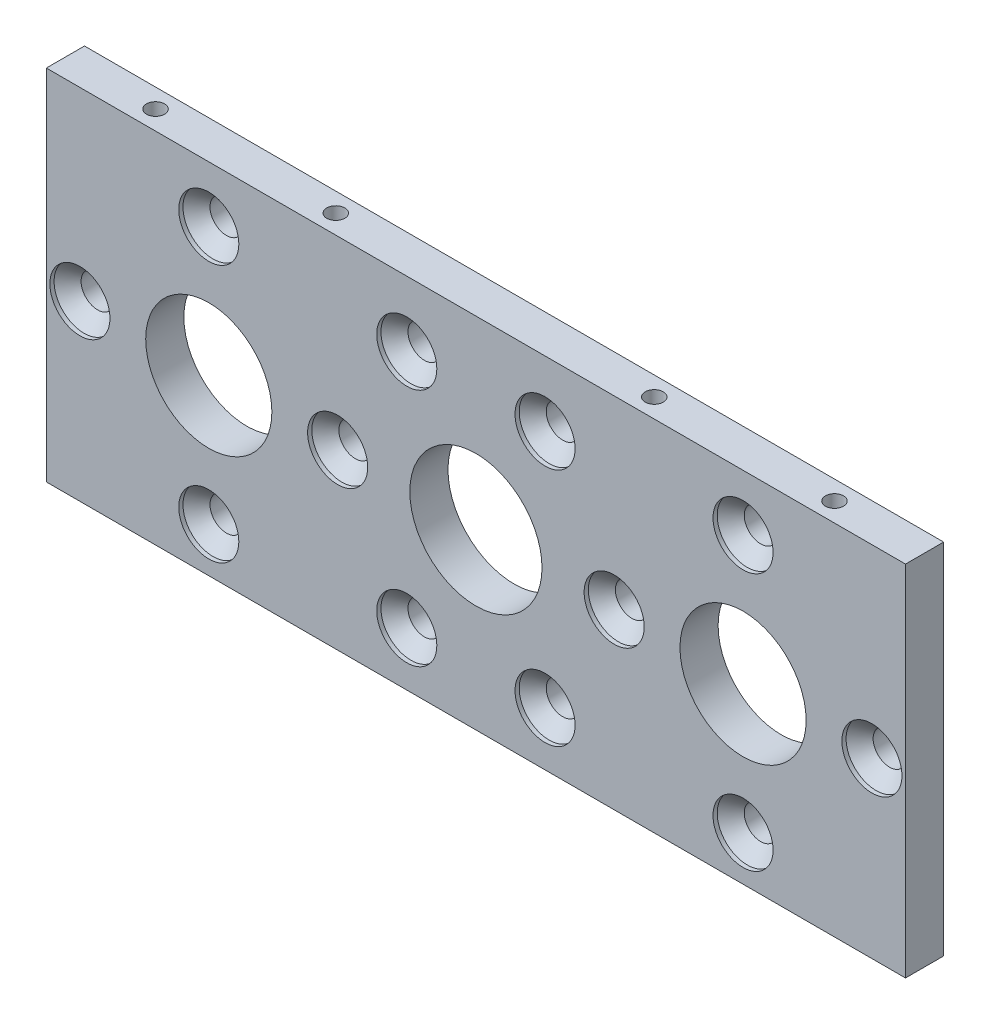
from build123d import *

# Parameters (mm, degrees)
ESBO_O1_W                        = 143.01
ESBO_O1_H                        = 54.05
RESSALTO_EXTRUS_O1_DEPTH         = 6.35
ESBO_O2_R                        = 2.75
CORTE_EXTRUS_O1_DEPTH            = 10
ESBO_O3_R                        = 10.5
ESBO_O3_R_2                      = 11
CORTE_EXTRUS_O2_DEPTH            = 10
ESBO_O4_W                        = 143.01
ESBO_O4_H                        = 3.62
RESSALTO_EXTRUS_O2_DEPTH         = 6.35
CROQUIS1_W                       = 143.01
CROQUIS1_H                       = 2
SALIENTE_EXTRUIR1_DEPTH          = 6.35
ESBO_O8_R                        = 1.5
CORTE_EXTRUS_O3_DEPTH            = 17
ESBO_O9_R                        = 5
CORTE_EXTRUS_O4_DEPTH            = 0.7
ESBO_O12_R                       = 5
CORTE_EXTRUS_O5_DEPTH            = 2.5
CORTE_EXTRUS_O5_DRAFT            = -45
CORTE_EXTRUS_O5_PROFILE_2_DEPTH  = 2.5
CORTE_EXTRUS_O5_PROFILE_2_DRAFT  = -45
CORTE_EXTRUS_O5_PROFILE_3_DEPTH  = 2.5
CORTE_EXTRUS_O5_PROFILE_3_DRAFT  = -45
CORTE_EXTRUS_O5_PROFILE_4_DEPTH  = 2.5
CORTE_EXTRUS_O5_PROFILE_4_DRAFT  = -45
CORTE_EXTRUS_O5_PROFILE_5_DEPTH  = 2.5
CORTE_EXTRUS_O5_PROFILE_5_DRAFT  = -45
CORTE_EXTRUS_O5_PROFILE_6_DEPTH  = 2.5
CORTE_EXTRUS_O5_PROFILE_6_DRAFT  = -45
CORTE_EXTRUS_O5_PROFILE_7_DEPTH  = 2.5
CORTE_EXTRUS_O5_PROFILE_7_DRAFT  = -45
CORTE_EXTRUS_O5_PROFILE_8_DEPTH  = 2.5
CORTE_EXTRUS_O5_PROFILE_8_DRAFT  = -45
CORTE_EXTRUS_O5_PROFILE_9_DEPTH  = 2.5
CORTE_EXTRUS_O5_PROFILE_9_DRAFT  = -45
CORTE_EXTRUS_O5_PROFILE_10_DEPTH = 2.5
CORTE_EXTRUS_O5_PROFILE_10_DRAFT = -45
CORTE_EXTRUS_O5_PROFILE_11_DEPTH = 2.5
CORTE_EXTRUS_O5_PROFILE_11_DRAFT = -45
CORTE_EXTRUS_O5_PROFILE_12_DEPTH = 2.5
CORTE_EXTRUS_O5_PROFILE_12_DRAFT = -45


with BuildPart() as part:
    # Esboço1 → Ressalto-extrusão1 (new body)
    with BuildSketch(Plane.XY):
        Rectangle(ESBO_O1_W, ESBO_O1_H)
    extrude(amount=RESSALTO_EXTRUS_O1_DEPTH)

    # Esboço2 → Corte-extrusão1 (cut)
    with BuildSketch(Plane(origin=(0, 0, 0), x_dir=(-1, 0, 0), z_dir=(0, 0, -1))):
        with Locations((-44.463136928, 23.291850449)):
            Circle(ESBO_O2_R)
        with Locations((-65.913136928, 1.841850449)):
            Circle(ESBO_O2_R)
        with Locations((-44.463136928, -19.608149551)):
            Circle(ESBO_O2_R)
        with Locations((-23.013136928, 1.841850449)):
            Circle(ESBO_O2_R)
        with Locations((-11.505636928, 21.773425117)):
            Circle(ESBO_O2_R)
        with Locations((11.509363072, 21.773425117)):
            Circle(ESBO_O2_R)
        with Locations((23.016863072, 1.841850449)):
            Circle(ESBO_O2_R)
        with Locations((11.509363072, -18.089724219)):
            Circle(ESBO_O2_R)
        with Locations((-11.505636928, -18.089724219)):
            Circle(ESBO_O2_R)
        with Locations((44.466863072, -19.608149551)):
            Circle(ESBO_O2_R)
        with Locations((65.916863072, 1.841850449)):
            Circle(ESBO_O2_R)
        with Locations((44.466863072, 23.291850449)):
            Circle(ESBO_O2_R)
    extrude(amount=-CORTE_EXTRUS_O1_DEPTH, mode=Mode.SUBTRACT)

    # Esboço3 → Corte-extrusão2 (cut)
    with BuildSketch(Plane(origin=(0, 0, 0), x_dir=(-1, 0, 0), z_dir=(0, 0, -1))):
        with Locations((-44.463136928, 1.841850449)):
            Circle(ESBO_O3_R)
        with Locations((0.001863072, 1.841850449)):
            Circle(ESBO_O3_R_2)
        with Locations((44.466863072, 1.841850449)):
            Circle(ESBO_O3_R)
    extrude(amount=-CORTE_EXTRUS_O2_DEPTH, mode=Mode.SUBTRACT)

    # Esboço4 → Ressalto-extrusão2 (add)
    with BuildSketch(Plane.XY):
        with Locations((0, 28.835)):
            Rectangle(ESBO_O4_W, ESBO_O4_H)
    extrude(amount=RESSALTO_EXTRUS_O2_DEPTH)

    # Croquis1 → Saliente-Extruir1 (add)
    with BuildSketch(Plane(origin=(0, 0, 0), x_dir=(-1, 0, 0), z_dir=(0, 0, -1))):
        with Locations((0, 31.645)):
            Rectangle(CROQUIS1_W, CROQUIS1_H)
    extrude(amount=-SALIENTE_EXTRUIR1_DEPTH)

    # Esboço8 → Corte-extrusão3 (cut)
    with BuildSketch(Plane(origin=(0, 32.645, 0), x_dir=(1, 0, 0), z_dir=(0, 1, 0))):
        with Locations(Location((56.505, -3.175, 0), (0, 0, 270))):
            Circle(ESBO_O8_R)
        with Locations(Location((26.505, -3.175, 0), (0, 0, 270))):
            Circle(ESBO_O8_R)
        with Locations(Location((-26.505, -3.175, 0), (0, 0, 90))):
            Circle(ESBO_O8_R)
        with Locations(Location((-56.505, -3.175, 0), (0, 0, 90))):
            Circle(ESBO_O8_R)
    extrude(amount=-CORTE_EXTRUS_O3_DEPTH, mode=Mode.SUBTRACT)

    # Esboço9 → Corte-extrusão4 (cut)
    with BuildSketch(Plane.XY.offset(6.35)):
        with Locations((44.463136928, -19.608149551)):
            Circle(ESBO_O9_R)
        with Locations((65.913136928, 1.841850449)):
            Circle(ESBO_O9_R)
        with Locations((44.463136928, 23.291850449)):
            Circle(ESBO_O9_R)
        with Locations((23.013136928, 1.841850449)):
            Circle(ESBO_O9_R)
        with Locations((11.505636928, -18.089724219)):
            Circle(ESBO_O9_R)
        with Locations((11.505636928, 21.773425117)):
            Circle(ESBO_O9_R)
        with Locations((-11.509363072, 21.773425117)):
            Circle(ESBO_O9_R)
        with Locations((-23.016863072, 1.841850449)):
            Circle(ESBO_O9_R)
        with Locations((-11.509363072, -18.089724219)):
            Circle(ESBO_O9_R)
        with Locations((-44.466863072, 23.291850449)):
            Circle(ESBO_O9_R)
        with Locations((-65.916863072, 1.841850449)):
            Circle(ESBO_O9_R)
        with Locations((-44.466863072, -19.608149551)):
            Circle(ESBO_O9_R)
    extrude(amount=-CORTE_EXTRUS_O4_DEPTH, mode=Mode.SUBTRACT)


with BuildPart() as corte_extrus_o5_tool:
    # Esboço12 → Corte-extrusão5 (with draft: the straight prism first)
    with BuildSketch(Plane.XY.offset(5.65)):
        with Locations((-65.916863072, 1.841850449)):
            Circle(ESBO_O12_R)
    extrude(amount=-CORTE_EXTRUS_O5_DEPTH)
    # Corte-extrusão5: the draft: its side faces are tilted about the plane it starts from
    corte_extrus_o5_sides = [corte_extrus_o5_tool.faces().sort_by_distance(p)[0] for p in [
        (-70.916863072, 1.841850449, 4.4),
    ]]
    draft(corte_extrus_o5_sides, Plane.XY.offset(5.65), CORTE_EXTRUS_O5_DRAFT)


with BuildPart() as part_1:
    add(part.part)

    # Corte-extrusão5: cut by corte_extrus_o5_tool
    add(corte_extrus_o5_tool.part, mode=Mode.SUBTRACT)


with BuildPart() as corte_extrus_o5_profile_2_tool:
    # Esboço12 → Corte-extrusão5 profile 2 (with draft: the straight prism first)
    with BuildSketch(Plane.XY.offset(5.65)):
        with Locations((-44.466863072, 23.291850449)):
            Circle(ESBO_O12_R)
    extrude(amount=-CORTE_EXTRUS_O5_PROFILE_2_DEPTH)
    # Corte-extrusão5 profile 2: the draft: its side faces are tilted about the plane it starts from
    corte_extrus_o5_profile_2_sides = [corte_extrus_o5_profile_2_tool.faces().sort_by_distance(p)[0] for p in [
        (-49.466863072, 23.291850449, 4.4),
    ]]
    draft(corte_extrus_o5_profile_2_sides, Plane.XY.offset(5.65), CORTE_EXTRUS_O5_PROFILE_2_DRAFT)


with BuildPart() as part_2:
    add(part_1.part)

    # Corte-extrusão5 profile 2: cut by corte_extrus_o5_profile_2_tool
    add(corte_extrus_o5_profile_2_tool.part, mode=Mode.SUBTRACT)


with BuildPart() as corte_extrus_o5_profile_3_tool:
    # Esboço12 → Corte-extrusão5 profile 3 (with draft: the straight prism first)
    with BuildSketch(Plane.XY.offset(5.65)):
        with Locations((-23.016863072, 1.841850449)):
            Circle(ESBO_O12_R)
    extrude(amount=-CORTE_EXTRUS_O5_PROFILE_3_DEPTH)
    # Corte-extrusão5 profile 3: the draft: its side faces are tilted about the plane it starts from
    corte_extrus_o5_profile_3_sides = [corte_extrus_o5_profile_3_tool.faces().sort_by_distance(p)[0] for p in [
        (-28.016863072, 1.841850449, 4.4),
    ]]
    draft(corte_extrus_o5_profile_3_sides, Plane.XY.offset(5.65), CORTE_EXTRUS_O5_PROFILE_3_DRAFT)


with BuildPart() as part_3:
    add(part_2.part)

    # Corte-extrusão5 profile 3: cut by corte_extrus_o5_profile_3_tool
    add(corte_extrus_o5_profile_3_tool.part, mode=Mode.SUBTRACT)


with BuildPart() as corte_extrus_o5_profile_4_tool:
    # Esboço12 → Corte-extrusão5 profile 4 (with draft: the straight prism first)
    with BuildSketch(Plane.XY.offset(5.65)):
        with Locations((-11.509363072, 21.773425117)):
            Circle(ESBO_O12_R)
    extrude(amount=-CORTE_EXTRUS_O5_PROFILE_4_DEPTH)
    # Corte-extrusão5 profile 4: the draft: its side faces are tilted about the plane it starts from
    corte_extrus_o5_profile_4_sides = [corte_extrus_o5_profile_4_tool.faces().sort_by_distance(p)[0] for p in [
        (-16.509363072, 21.773425117, 4.4),
    ]]
    draft(corte_extrus_o5_profile_4_sides, Plane.XY.offset(5.65), CORTE_EXTRUS_O5_PROFILE_4_DRAFT)


with BuildPart() as part_4:
    add(part_3.part)

    # Corte-extrusão5 profile 4: cut by corte_extrus_o5_profile_4_tool
    add(corte_extrus_o5_profile_4_tool.part, mode=Mode.SUBTRACT)


with BuildPart() as corte_extrus_o5_profile_5_tool:
    # Esboço12 → Corte-extrusão5 profile 5 (with draft: the straight prism first)
    with BuildSketch(Plane.XY.offset(5.65)):
        with Locations((-44.466863072, -19.608149551)):
            Circle(ESBO_O12_R)
    extrude(amount=-CORTE_EXTRUS_O5_PROFILE_5_DEPTH)
    # Corte-extrusão5 profile 5: the draft: its side faces are tilted about the plane it starts from
    corte_extrus_o5_profile_5_sides = [corte_extrus_o5_profile_5_tool.faces().sort_by_distance(p)[0] for p in [
        (-49.466863072, -19.608149551, 4.4),
    ]]
    draft(corte_extrus_o5_profile_5_sides, Plane.XY.offset(5.65), CORTE_EXTRUS_O5_PROFILE_5_DRAFT)


with BuildPart() as part_5:
    add(part_4.part)

    # Corte-extrusão5 profile 5: cut by corte_extrus_o5_profile_5_tool
    add(corte_extrus_o5_profile_5_tool.part, mode=Mode.SUBTRACT)


with BuildPart() as corte_extrus_o5_profile_6_tool:
    # Esboço12 → Corte-extrusão5 profile 6 (with draft: the straight prism first)
    with BuildSketch(Plane.XY.offset(5.65)):
        with Locations((-11.509363072, -18.089724219)):
            Circle(ESBO_O12_R)
    extrude(amount=-CORTE_EXTRUS_O5_PROFILE_6_DEPTH)
    # Corte-extrusão5 profile 6: the draft: its side faces are tilted about the plane it starts from
    corte_extrus_o5_profile_6_sides = [corte_extrus_o5_profile_6_tool.faces().sort_by_distance(p)[0] for p in [
        (-16.509363072, -18.089724219, 4.4),
    ]]
    draft(corte_extrus_o5_profile_6_sides, Plane.XY.offset(5.65), CORTE_EXTRUS_O5_PROFILE_6_DRAFT)


with BuildPart() as part_6:
    add(part_5.part)

    # Corte-extrusão5 profile 6: cut by corte_extrus_o5_profile_6_tool
    add(corte_extrus_o5_profile_6_tool.part, mode=Mode.SUBTRACT)


with BuildPart() as corte_extrus_o5_profile_7_tool:
    # Esboço12 → Corte-extrusão5 profile 7 (with draft: the straight prism first)
    with BuildSketch(Plane.XY.offset(5.65)):
        with Locations((11.505636928, -18.089724219)):
            Circle(ESBO_O12_R)
    extrude(amount=-CORTE_EXTRUS_O5_PROFILE_7_DEPTH)
    # Corte-extrusão5 profile 7: the draft: its side faces are tilted about the plane it starts from
    corte_extrus_o5_profile_7_sides = [corte_extrus_o5_profile_7_tool.faces().sort_by_distance(p)[0] for p in [
        (6.505636928, -18.089724219, 4.4),
    ]]
    draft(corte_extrus_o5_profile_7_sides, Plane.XY.offset(5.65), CORTE_EXTRUS_O5_PROFILE_7_DRAFT)


with BuildPart() as part_7:
    add(part_6.part)

    # Corte-extrusão5 profile 7: cut by corte_extrus_o5_profile_7_tool
    add(corte_extrus_o5_profile_7_tool.part, mode=Mode.SUBTRACT)


with BuildPart() as corte_extrus_o5_profile_8_tool:
    # Esboço12 → Corte-extrusão5 profile 8 (with draft: the straight prism first)
    with BuildSketch(Plane.XY.offset(5.65)):
        with Locations((44.463136928, -19.608149551)):
            Circle(ESBO_O12_R)
    extrude(amount=-CORTE_EXTRUS_O5_PROFILE_8_DEPTH)
    # Corte-extrusão5 profile 8: the draft: its side faces are tilted about the plane it starts from
    corte_extrus_o5_profile_8_sides = [corte_extrus_o5_profile_8_tool.faces().sort_by_distance(p)[0] for p in [
        (39.463136928, -19.608149551, 4.4),
    ]]
    draft(corte_extrus_o5_profile_8_sides, Plane.XY.offset(5.65), CORTE_EXTRUS_O5_PROFILE_8_DRAFT)


with BuildPart() as part_8:
    add(part_7.part)

    # Corte-extrusão5 profile 8: cut by corte_extrus_o5_profile_8_tool
    add(corte_extrus_o5_profile_8_tool.part, mode=Mode.SUBTRACT)


with BuildPart() as corte_extrus_o5_profile_9_tool:
    # Esboço12 → Corte-extrusão5 profile 9 (with draft: the straight prism first)
    with BuildSketch(Plane.XY.offset(5.65)):
        with Locations((23.013136928, 1.841850449)):
            Circle(ESBO_O12_R)
    extrude(amount=-CORTE_EXTRUS_O5_PROFILE_9_DEPTH)
    # Corte-extrusão5 profile 9: the draft: its side faces are tilted about the plane it starts from
    corte_extrus_o5_profile_9_sides = [corte_extrus_o5_profile_9_tool.faces().sort_by_distance(p)[0] for p in [
        (18.013136928, 1.841850449, 4.4),
    ]]
    draft(corte_extrus_o5_profile_9_sides, Plane.XY.offset(5.65), CORTE_EXTRUS_O5_PROFILE_9_DRAFT)


with BuildPart() as part_9:
    add(part_8.part)

    # Corte-extrusão5 profile 9: cut by corte_extrus_o5_profile_9_tool
    add(corte_extrus_o5_profile_9_tool.part, mode=Mode.SUBTRACT)


with BuildPart() as corte_extrus_o5_profile_10_tool:
    # Esboço12 → Corte-extrusão5 profile 10 (with draft: the straight prism first)
    with BuildSketch(Plane.XY.offset(5.65)):
        with Locations((65.913136928, 1.841850449)):
            Circle(ESBO_O12_R)
    extrude(amount=-CORTE_EXTRUS_O5_PROFILE_10_DEPTH)
    # Corte-extrusão5 profile 10: the draft: its side faces are tilted about the plane it starts from
    corte_extrus_o5_profile_10_sides = [corte_extrus_o5_profile_10_tool.faces().sort_by_distance(p)[0] for p in [
        (60.913136928, 1.841850449, 4.4),
    ]]
    draft(corte_extrus_o5_profile_10_sides, Plane.XY.offset(5.65), CORTE_EXTRUS_O5_PROFILE_10_DRAFT)


with BuildPart() as part_10:
    add(part_9.part)

    # Corte-extrusão5 profile 10: cut by corte_extrus_o5_profile_10_tool
    add(corte_extrus_o5_profile_10_tool.part, mode=Mode.SUBTRACT)


with BuildPart() as corte_extrus_o5_profile_11_tool:
    # Esboço12 → Corte-extrusão5 profile 11 (with draft: the straight prism first)
    with BuildSketch(Plane.XY.offset(5.65)):
        with Locations((44.463136928, 23.291850449)):
            Circle(ESBO_O12_R)
    extrude(amount=-CORTE_EXTRUS_O5_PROFILE_11_DEPTH)
    # Corte-extrusão5 profile 11: the draft: its side faces are tilted about the plane it starts from
    corte_extrus_o5_profile_11_sides = [corte_extrus_o5_profile_11_tool.faces().sort_by_distance(p)[0] for p in [
        (39.463136928, 23.291850449, 4.4),
    ]]
    draft(corte_extrus_o5_profile_11_sides, Plane.XY.offset(5.65), CORTE_EXTRUS_O5_PROFILE_11_DRAFT)


with BuildPart() as part_11:
    add(part_10.part)

    # Corte-extrusão5 profile 11: cut by corte_extrus_o5_profile_11_tool
    add(corte_extrus_o5_profile_11_tool.part, mode=Mode.SUBTRACT)


with BuildPart() as corte_extrus_o5_profile_12_tool:
    # Esboço12 → Corte-extrusão5 profile 12 (with draft: the straight prism first)
    with BuildSketch(Plane.XY.offset(5.65)):
        with Locations((11.505636928, 21.773425117)):
            Circle(ESBO_O12_R)
    extrude(amount=-CORTE_EXTRUS_O5_PROFILE_12_DEPTH)
    # Corte-extrusão5 profile 12: the draft: its side faces are tilted about the plane it starts from
    corte_extrus_o5_profile_12_sides = [corte_extrus_o5_profile_12_tool.faces().sort_by_distance(p)[0] for p in [
        (6.505636928, 21.773425117, 4.4),
    ]]
    draft(corte_extrus_o5_profile_12_sides, Plane.XY.offset(5.65), CORTE_EXTRUS_O5_PROFILE_12_DRAFT)


with BuildPart() as part_12:
    add(part_11.part)

    # Corte-extrusão5 profile 12: cut by corte_extrus_o5_profile_12_tool
    add(corte_extrus_o5_profile_12_tool.part, mode=Mode.SUBTRACT)


solid = part_12.part
